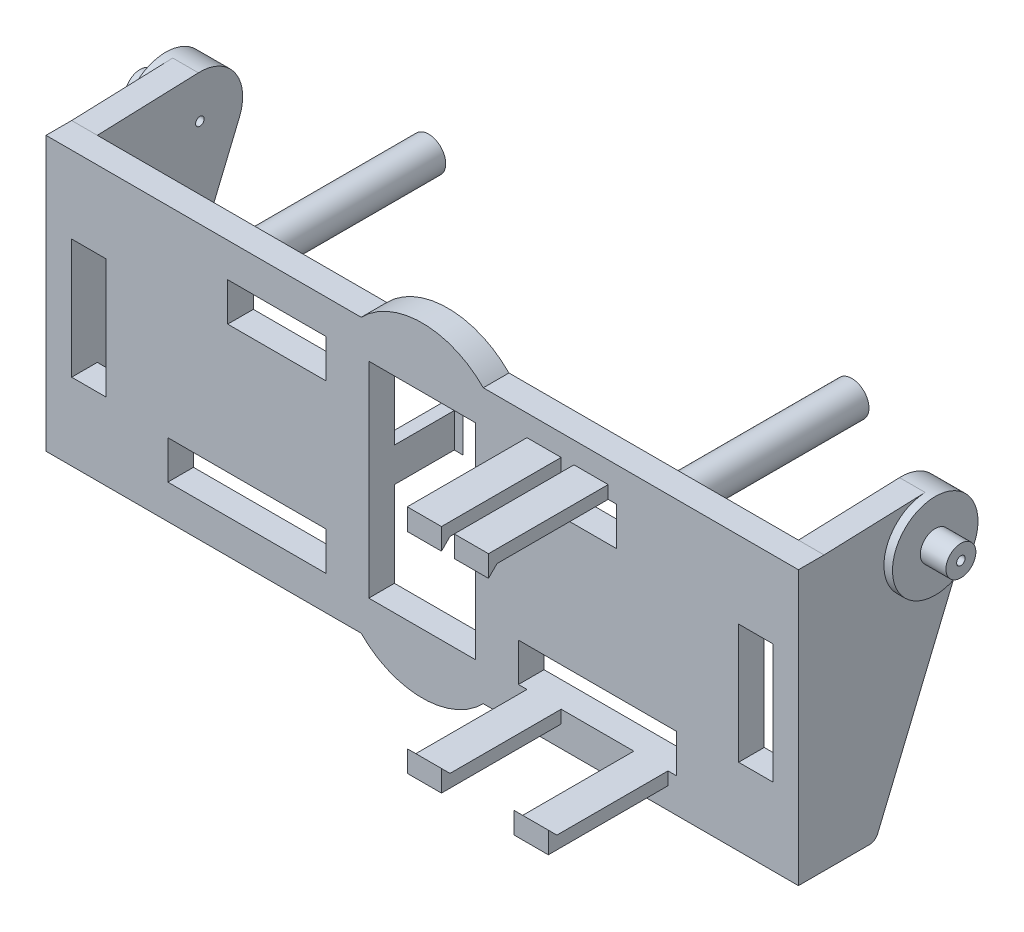
from build123d import *

# Parameters (mm, degrees)
ESQUISSE1_W             = 11.5
ESQUISSE1_H             = 4.5
ESQUISSE1_W_2           = 18.5
ESQUISSE1_W_3           = 4
ESQUISSE1_H_2           = 14
BOSS_EXTRU_1_DEPTH      = 3
BOSS_EXTRU_2_DEPTH      = 3
ESQUISSE3_R             = 2
ESQUISSE3_R_2           = 0.5
BOSS_EXTRU_3_DEPTH      = 22.5
BOSS_EXTRU_4_START      = 1
ESQUISSE4_R             = 5
BOSS_EXTRU_4_DEPTH      = 1
ESQUISSE5_R             = 1.75
BOSS_EXTRU_5_DEPTH      = 3
ESQUISSE6_R             = 0.5
ENL_V_MAT_EXTRU_1_DEPTH = 7
ESQUISSE8_W             = 1.5
ESQUISSE8_H             = 4
BOSS_EXTRU_7_DEPTH      = 8
BOSS_EXTRU_8_DEPTH      = 4
BOSS_EXTRU_6_DEPTH      = 3
ESQUISSE10_W            = 4
ESQUISSE10_H            = 1.5
BOSS_EXTRU_9_DEPTH      = 14
BOSS_EXTRU_11_DEPTH     = 4
BOSS_EXTRU_12_DEPTH     = 4
BOSS_EXTRU_13_DEPTH     = 4
BOSS_EXTRU_14_DEPTH     = 4


with BuildPart() as part:
    # Esquisse1 → Boss.-Extru.1 (new body)
    with BuildSketch(Plane.XY):
        Polygon((-44, 32), (-44, 28), (-37.75, 28), (-37.75, 4), (-44, 4), (-44, 0), (0, 0), (0, 32), align=None)
        with Locations((-27, 25.75)):
            Rectangle(ESQUISSE1_W, ESQUISSE1_H, mode=Mode.SUBTRACT)
        with Locations((-23.5, 6.25)):
            Rectangle(ESQUISSE1_W_2, ESQUISSE1_H, mode=Mode.SUBTRACT)
        with Locations((-5, 16)):
            Rectangle(ESQUISSE1_W_3, ESQUISSE1_H_2, mode=Mode.SUBTRACT)
    boss_extru_1 = extrude(amount=BOSS_EXTRU_1_DEPTH)

    # Esquisse2 → Boss.-Extru.2 (add)
    with BuildSketch(Plane(origin=(0, 0, 0), x_dir=(0, 0, -1), z_dir=(1, 0, 0))):
        with BuildLine():
            Line((0, 32), (11.822414385, 32.42016324))
            ThreePointArc((11.822414385, 32.42016324), (16.109871823, 30.270940346), (16.616008757, 25.501739602))
            Line((16.616008757, 25.501739602), (6.256300568, 0.61568434))
            ThreePointArc((6.256300568, 0.61568434), (5.887934081, 0.168039767), (5.333098817, 0))
            Line((5.333098817, 0), (0, 0))
            Line((0, 0), (0, 32))
        make_face()
    boss_extru_2 = extrude(amount=-BOSS_EXTRU_2_DEPTH)

    # Esquisse3 → Boss.-Extru.3 (add)
    with BuildSketch(Plane(origin=(0, 0, 0), x_dir=(-1, 0, 0), z_dir=(0, 0, -1))):
        with Locations((19.25, 27)):
            Circle(ESQUISSE3_R)
        with Locations((19.25, 27)):
            Circle(ESQUISSE3_R_2, mode=Mode.SUBTRACT)
    boss_extru_3 = extrude(amount=BOSS_EXTRU_3_DEPTH)

    # Esquisse4 → Boss.-Extru.4 (add)
    with BuildSketch(Plane(origin=(0, 0, 0), x_dir=(0, 0, -1), z_dir=(1, 0, 0)).offset(BOSS_EXTRU_4_START)):
        with Locations((12, 27.4233179)):
            Circle(ESQUISSE4_R)
    boss_extru_4 = extrude(amount=-BOSS_EXTRU_4_DEPTH)

    # Esquisse5 → Boss.-Extru.5 (add)
    with BuildSketch(Plane(origin=(1, 0, 0), x_dir=(0, 0, -1), z_dir=(1, 0, 0))):
        with Locations((12, 27.4233179)):
            Circle(ESQUISSE5_R)
    boss_extru_5 = extrude(amount=BOSS_EXTRU_5_DEPTH)

    # Esquisse6 → Enlèv. mat.-Extru.1 (cut)
    with BuildSketch(Plane(origin=(4, 0, 0), x_dir=(0, 0, -1), z_dir=(1, 0, 0))):
        with Locations((12, 27.4233179)):
            Circle(ESQUISSE6_R)
    enl_v_mat_extru_1 = extrude(amount=-ENL_V_MAT_EXTRU_1_DEPTH, mode=Mode.SUBTRACT)

    # Esquisse8 → Boss.-Extru.7 (add)
    with BuildSketch(Plane(origin=(0, 0, 0), x_dir=(-1, 0, 0), z_dir=(0, 0, -1))):
        with Locations((37, 16)):
            Rectangle(ESQUISSE8_W, ESQUISSE8_H)
    boss_extru_7 = extrude(amount=BOSS_EXTRU_7_DEPTH)

    # Esquisse9 → Boss.-Extru.8 (add)
    with BuildSketch(Plane.XZ.offset(-14)):
        Polygon((-37.75, -8), (-38.75, -7), (-37.75, -7), align=None)
    boss_extru_8 = extrude(amount=-BOSS_EXTRU_8_DEPTH)

    # Symétrie1: Boss.-Extru.1, Boss.-Extru.2, Boss.-Extru.3, Boss.-Extru.4, Boss.-Extru.5, Enlèv. mat.-Extru.1, Boss.-Extru.7, Boss.-Extru.8 across plane
    add(boss_extru_1.mirror(Plane(origin=(-44, 32, 3), x_dir=(0, 0, 1), z_dir=(1, 0, 0))))
    add(boss_extru_2.mirror(Plane(origin=(-44, 32, 3), x_dir=(0, 0, 1), z_dir=(1, 0, 0))))
    add(boss_extru_3.mirror(Plane(origin=(-44, 32, 3), x_dir=(0, 0, 1), z_dir=(1, 0, 0))))
    add(boss_extru_4.mirror(Plane(origin=(-44, 32, 3), x_dir=(0, 0, 1), z_dir=(1, 0, 0))))
    add(boss_extru_5.mirror(Plane(origin=(-44, 32, 3), x_dir=(0, 0, 1), z_dir=(1, 0, 0))))
    add(enl_v_mat_extru_1.mirror(Plane(origin=(-44, 32, 3), x_dir=(0, 0, 1), z_dir=(1, 0, 0))), mode=Mode.SUBTRACT)
    add(boss_extru_7.mirror(Plane(origin=(-44, 32, 3), x_dir=(0, 0, 1), z_dir=(1, 0, 0))))
    add(boss_extru_8.mirror(Plane(origin=(-44, 32, 3), x_dir=(0, 0, 1), z_dir=(1, 0, 0))))

    # Esquisse7 → Boss.-Extru.6 (add)
    with BuildSketch(Plane(origin=(0, 0, 0), x_dir=(-1, 0, 0), z_dir=(0, 0, -1))):
        with BuildLine():
            Line((35.391133561, 30.087968026), (52.608866439, 30.087968026))
            ThreePointArc((52.608866439, 30.087968026), (44, 35), (35.391133561, 30.087968026))
        make_face()
    boss_extru_6 = extrude(amount=-BOSS_EXTRU_6_DEPTH)

    # Symétrie2: Boss.-Extru.6 across plane
    add(boss_extru_6.mirror(Plane(origin=(0, 16, 0), x_dir=(0, 0, 1), z_dir=(0, -1, 0))))

    # Esquisse10 → Boss.-Extru.9 (add)
    with BuildSketch(Plane.XY.offset(3)):
        with Locations((-29.75, 28.75)):
            Rectangle(ESQUISSE10_W, ESQUISSE10_H)
        with Locations((-24.25, 28.75)):
            Rectangle(ESQUISSE10_W, ESQUISSE10_H)
        with Locations((-29.75, 3.25)):
            Rectangle(ESQUISSE10_W, ESQUISSE10_H)
        with Locations((-17.25, 3.25)):
            Rectangle(ESQUISSE10_W, ESQUISSE10_H)
    extrude(amount=BOSS_EXTRU_9_DEPTH)

    # Esquisse11 → Boss.-Extru.11 (add)
    with BuildSketch(Plane(origin=(-15.25, 0, 0), x_dir=(0, 0, -1), z_dir=(1, 0, 0))):
        Polygon((-17, 4), (-17, 5), (-16, 4), align=None)
    extrude(amount=-BOSS_EXTRU_11_DEPTH)

    # Esquisse12 → Boss.-Extru.12 (add)
    with BuildSketch(Plane(origin=(-27.75, 0, 0), x_dir=(0, 0, -1), z_dir=(1, 0, 0))):
        Polygon((-17, 4), (-17, 5), (-16, 4), align=None)
    extrude(amount=-BOSS_EXTRU_12_DEPTH)

    # Esquisse13 → Boss.-Extru.13 (add)
    with BuildSketch(Plane(origin=(-22.25, 0, 0), x_dir=(0, 0, -1), z_dir=(1, 0, 0))):
        Polygon((-17, 28), (-17, 27), (-16, 28), align=None)
    extrude(amount=-BOSS_EXTRU_13_DEPTH)

    # Esquisse14 → Boss.-Extru.14 (add)
    with BuildSketch(Plane.ZY.offset(31.75)):
        Polygon((17, 28), (16, 28), (17, 27), align=None)
    extrude(amount=-BOSS_EXTRU_14_DEPTH)


solid = part.part
